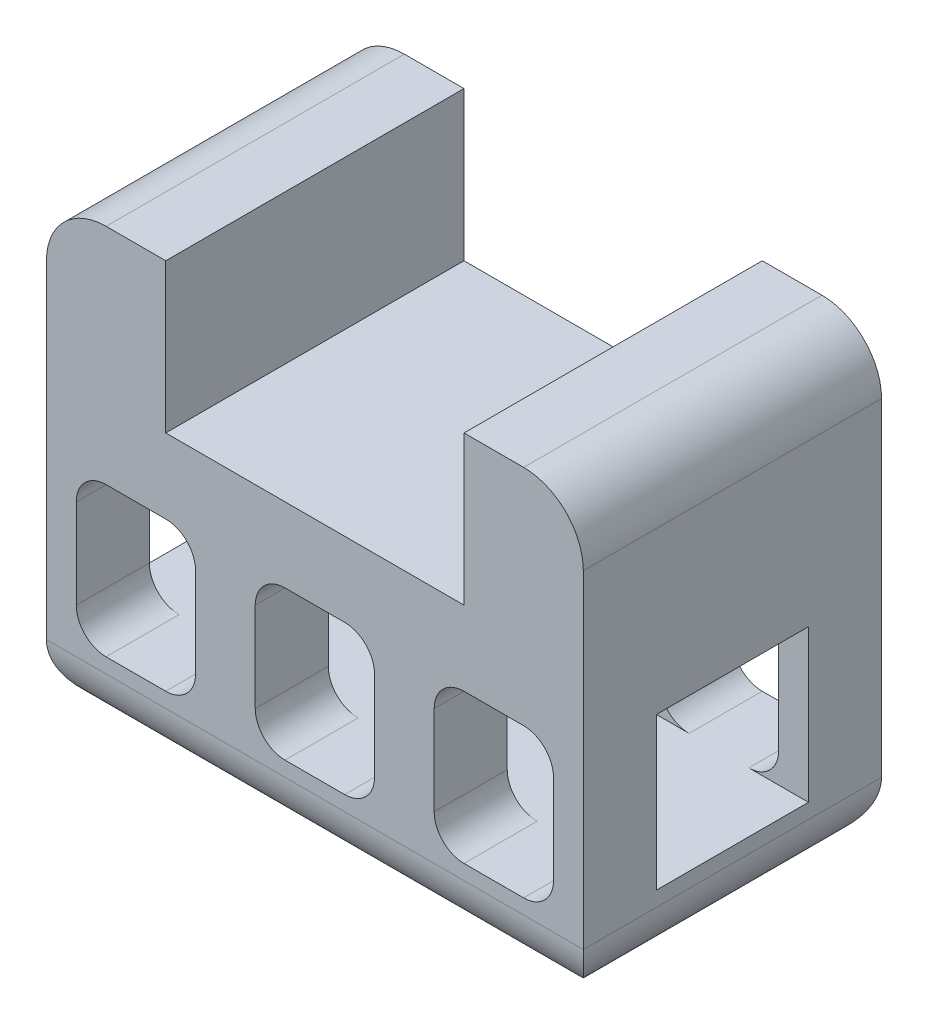
from build123d import *

# Parameters (mm, degrees)
BOSS_EXTRUDE1_DEPTH = 20
SKETCH5_W           = 10.2
SKETCH5_H           = 10.2
CUT_EXTRUDE2_DEPTH  = 44.829214002
SKETCH6_W           = 8
SKETCH6_H           = 10
CUT_EXTRUDE3_DEPTH  = 31.805843601
FILLET1_R           = 2
FILLET3_R           = 4
FILLET4_R           = 4


with BuildPart() as part:
    # Sketch1 → Boss-Extrude1 (new body)
    with BuildSketch(Plane.XY):
        Polygon((-10, 15), (-10, 5), (10, 5), (10, 15), (18, 15), (18, -15), (-18, -15), (-18, 15), align=None)
    extrude(amount=BOSS_EXTRUDE1_DEPTH)

    # Sketch5 → Cut-Extrude2 (cut, through all)
    with BuildSketch(Plane.ZY.offset(18)):
        with Locations((10, -4.9)):
            Rectangle(SKETCH5_W, SKETCH5_H)
    extrude(amount=-CUT_EXTRUDE2_DEPTH, mode=Mode.SUBTRACT)

    # Sketch6 → Cut-Extrude3 (cut, through all)
    with BuildSketch(Plane.XY.offset(20)):
        with Locations((0, -5)):
            Rectangle(SKETCH6_W, SKETCH6_H)
        with Locations((-12, -5)):
            Rectangle(SKETCH6_W, SKETCH6_H)
        with Locations((12, -5)):
            Rectangle(SKETCH6_W, SKETCH6_H)
    extrude(amount=-CUT_EXTRUDE3_DEPTH, mode=Mode.SUBTRACT)

    # Fillet1
    fillet1_edges = [part.edges().sort_by_distance(p)[0] for p in [
        (16, 0, 17.55),
        (16, 0, 2.45),
        (16, -10, 17.55),
        (16, -10, 2.45),
        (8, -10, 17.55),
        (8, -10, 2.45),
        (8, 0, 17.55),
        (8, 0, 2.45),
        (-4, -10, 17.55),
        (-4, -10, 2.45),
        (-4, 0, 17.55),
        (-4, 0, 2.45),
        (4, 0, 17.55),
        (4, 0, 2.45),
        (4, -10, 17.55),
        (4, -10, 2.45),
        (-16, -10, 17.55),
        (-16, -10, 2.45),
        (-16, 0, 17.55),
        (-16, 0, 2.45),
        (-8, 0, 17.55),
        (-8, 0, 2.45),
        (-8, -10, 17.55),
        (-8, -10, 2.45),
    ]]
    fillet(fillet1_edges, radius=FILLET1_R)

    # Fillet3
    fillet3_edges = [part.edges().sort_by_distance(p)[0] for p in [
        (0, -15, 0),
        (18, -15, 10),
        (-18, -15, 10),
        (0, -15, 20),
    ]]
    fillet(fillet3_edges, radius=FILLET3_R)

    # Fillet4
    fillet4_edges = [part.edges().sort_by_distance(p)[0] for p in [
        (18, 15, 10),
        (-18, 15, 10),
    ]]
    fillet(fillet4_edges, radius=FILLET4_R)


solid = part.part
